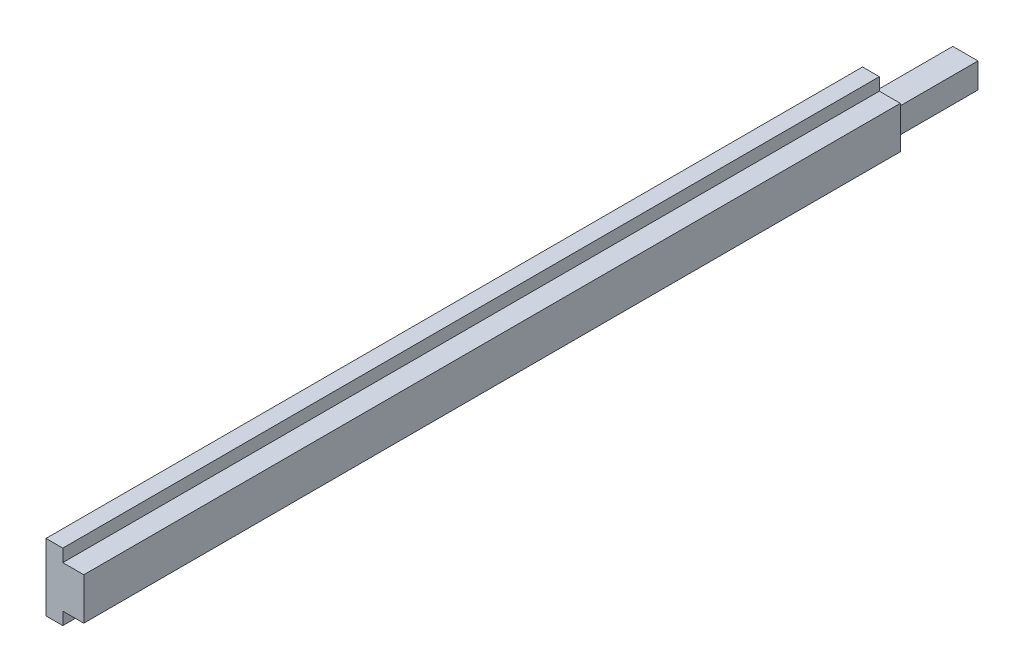
from build123d import *

# Parameters (mm, degrees)
SKETCH1_W           = 10
SKETCH1_H           = 5
SKETCH1_W_2         = 16
SKETCH1_H_2         = 4
BOSS_EXTRUDE1_DEPTH = 194.5
SKETCH2_W           = 6
SKETCH2_H           = 6
BOSS_EXTRUDE2_DEPTH = 20


with BuildPart() as part:
    # Sketch1 → Boss-Extrude1 (new body)
    with BuildSketch(Plane(origin=(0, 0, 0), x_dir=(0, 1, 0), z_dir=(0, 0, 1))):
        with Locations((0, -4.5)):
            Rectangle(SKETCH1_W, SKETCH1_H)
        Rectangle(SKETCH1_W_2, SKETCH1_H_2)
    extrude(amount=-BOSS_EXTRUDE1_DEPTH)

    # Sketch2 → Boss-Extrude2 (add)
    with BuildSketch(Plane(origin=(0, 0, -194.5), x_dir=(1, 0, 0), z_dir=(0, 0, -1))):
        with Locations((2.5, 0)):
            Rectangle(SKETCH2_W, SKETCH2_H)
    extrude(amount=BOSS_EXTRUDE2_DEPTH)


solid = part.part
